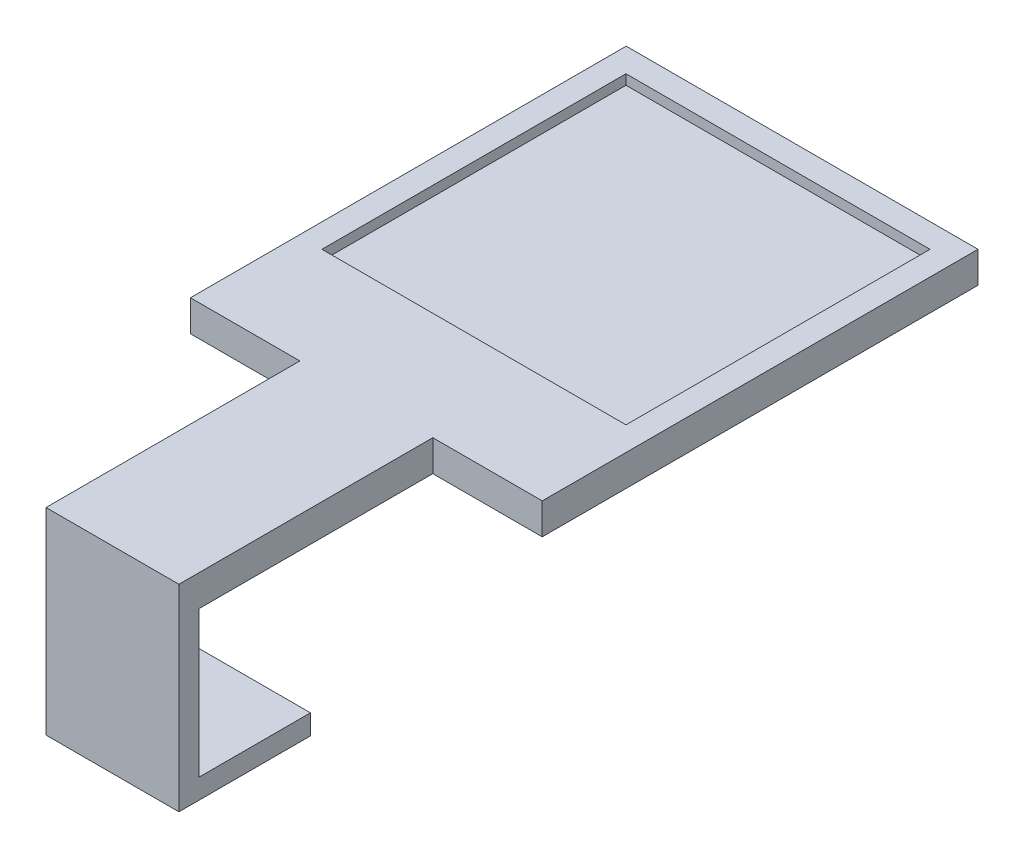
from build123d import *

# Parameters (mm, degrees)
SKETCH_1_W          = 17.6
SKETCH_1_H          = 21.8
EXTRUDE_1_DEPTH     = 1.56
SKETCH_2_W          = 15.21
SKETCH_2_H          = 15.21
CUT_EXTRUDE_1_DEPTH = 0.5
SKETCH_3_W          = 6.65
SKETCH_3_H          = 1.56
EXTRUDE_2_DEPTH     = 25.58
SKETCH_4_W          = 6.65
SKETCH_4_H          = 1
EXTRUDE_3_DEPTH     = 12.88
SKETCH_5_W          = 6.65
SKETCH_5_H          = 1
EXTRUDE_4_DEPTH     = 5.58
CUT_EXTRUDE_2_REACH = 45.766
SKETCH_6_W          = 6.65
SKETCH_6_H          = 12.88
CUT_EXTRUDE_3_REACH = 39.197
SKETCH_7_W          = 6.65
SKETCH_7_H          = 4.58


with BuildPart() as part:
    # 草图1 → 凸台-拉伸1 (new body)
    with BuildSketch(Plane(origin=(0, 0, 0), x_dir=(1, 0, 0), z_dir=(0, 1, 0))):
        with Locations((0.972375691, -4.190607735)):
            Rectangle(SKETCH_1_W, SKETCH_1_H)
    extrude(amount=EXTRUDE_1_DEPTH)

    # 草图2 → 切除-拉伸1 (cut)
    with BuildSketch(Plane(origin=(0, 1.56, 0), x_dir=(1, 0, 0), z_dir=(0, 1, 0))):
        with Locations((0.967375691, -2.095607735)):
            Rectangle(SKETCH_2_W, SKETCH_2_H)
    extrude(amount=-CUT_EXTRUDE_1_DEPTH, mode=Mode.SUBTRACT)

    # 草图3 → 凸台-拉伸2 (add)
    with BuildSketch(Plane.XY.offset(15.090607735)):
        with Locations((0.972375691, 0.78)):
            Rectangle(SKETCH_3_W, SKETCH_3_H)
    extrude(amount=EXTRUDE_2_DEPTH)

    # 草图4 → 凸台-拉伸3 (add)
    with BuildSketch(Plane(origin=(0, 0, 0), x_dir=(1, 0, 0), z_dir=(0, 1, 0))):
        with Locations((0.972375691, -27.290607735)):
            Rectangle(SKETCH_4_W, SKETCH_4_H)
    extrude(amount=-EXTRUDE_3_DEPTH)

    # 草图5 → 凸台-拉伸4 (add)
    with BuildSketch(Plane(origin=(0, 0, 26.790607735), x_dir=(-1, 0, 0), z_dir=(0, 0, -1))):
        with Locations((-0.972375691, -7.8)):
            Rectangle(SKETCH_5_W, SKETCH_5_H)
    extrude(amount=EXTRUDE_4_DEPTH)

    # 草图6 → 切除-拉伸2 (cut, up to next)
    with BuildSketch(Plane.XZ, mode=Mode.PRIVATE) as cut_extrude_2_sk1:
        with Locations((0.972375691, 34.230607735)):
            Rectangle(SKETCH_6_W, SKETCH_6_H)
    cut_extrude_2_tool1 = extrude(cut_extrude_2_sk1.sketch, amount=-CUT_EXTRUDE_2_REACH, mode=Mode.PRIVATE) & part.part
    add(cut_extrude_2_tool1.solids().sort_by_distance((0.972376, 0, 34.230608))[0], mode=Mode.SUBTRACT)

    # 草图7 → 切除-拉伸3 (cut, up to next)
    with BuildSketch(Plane(origin=(0, 0, 26.790607735), x_dir=(-1, 0, 0), z_dir=(0, 0, -1)), mode=Mode.PRIVATE) as cut_extrude_3_sk1:
        with Locations((-0.972375691, -10.59)):
            Rectangle(SKETCH_7_W, SKETCH_7_H)
    cut_extrude_3_tool1 = extrude(cut_extrude_3_sk1.sketch, amount=-CUT_EXTRUDE_3_REACH, mode=Mode.PRIVATE) & part.part
    add(cut_extrude_3_tool1.solids().sort_by_distance((0.972376, -10.59, 26.790608))[0], mode=Mode.SUBTRACT)


solid = part.part
